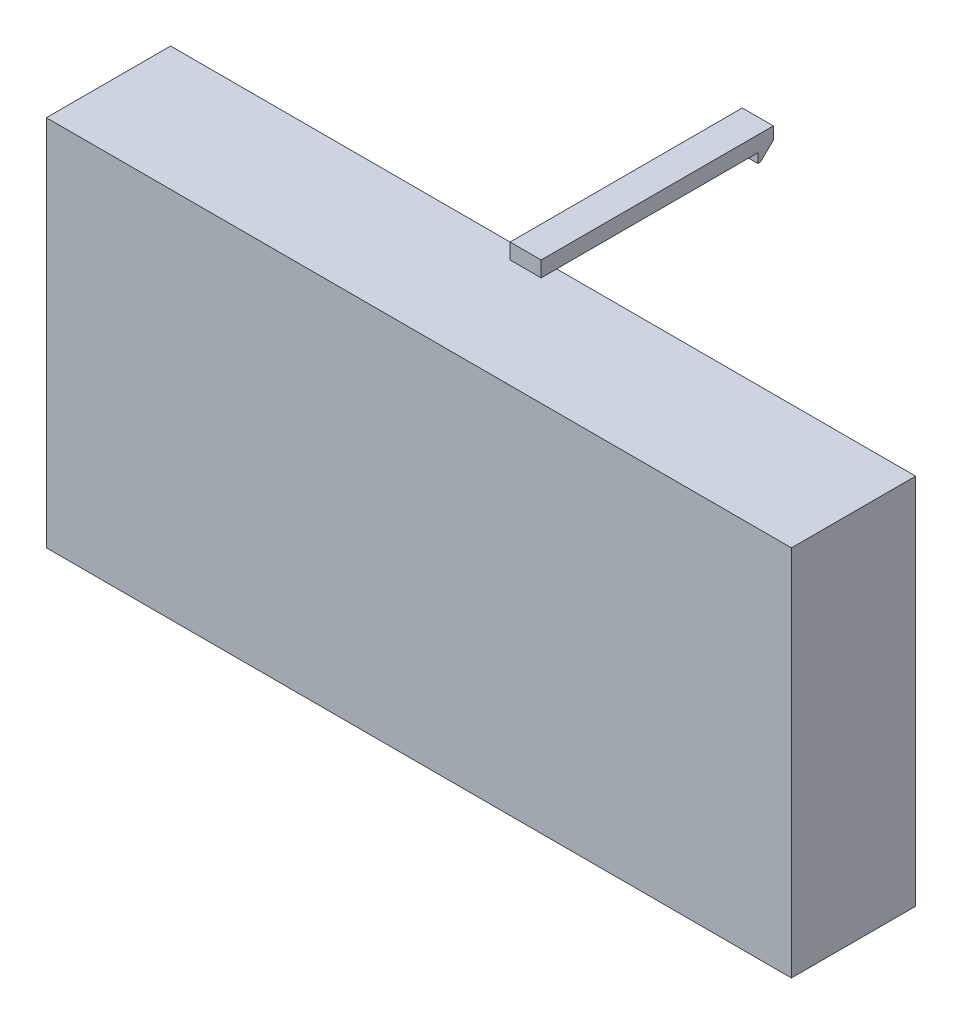
from build123d import *

# Parameters (mm, degrees)
SKETCH1_W           = 304.8
SKETCH1_H           = 152.4
BOSS_EXTRUDE1_DEPTH = 50.8
SHELL1_T            = -3.175
SKETCH3_W           = 12.7
SKETCH3_H           = 6.35
BOSS_EXTRUDE2_DEPTH = 6.35
SKETCH4_W           = 12.7
SKETCH4_H           = 6.35
BOSS_EXTRUDE3_DEPTH = 88.646
SKETCH5_W           = 12.7
SKETCH5_H           = 6.35
BOSS_EXTRUDE4_DEPTH = 3.81
CUT_EXTRUDE1_REACH  = 242.848


with BuildPart() as part:
    # Sketch1 → Boss-Extrude1 (new body)
    with BuildSketch(Plane.XY):
        with Locations((152.4, 76.2)):
            Rectangle(SKETCH1_W, SKETCH1_H)
    extrude(amount=BOSS_EXTRUDE1_DEPTH)

    # Shell1
    shell1_openings = [part.faces().sort_by_distance(p)[0] for p in [
        (152.4, 76.2, 0),
    ]]
    offset(amount=SHELL1_T, openings=shell1_openings, kind=Kind.INTERSECTION)

    # Sketch3 → Boss-Extrude2 (add)
    with BuildSketch(Plane(origin=(0, 152.4, 0), x_dir=(1, 0, 0), z_dir=(0, 1, 0))):
        with Locations((151.599627363, -3.175)):
            Rectangle(SKETCH3_W, SKETCH3_H)
    boss_extrude2 = extrude(amount=BOSS_EXTRUDE2_DEPTH)

    # Sketch4 → Boss-Extrude3 (add)
    with BuildSketch(Plane(origin=(0, 0, 0), x_dir=(-1, 0, 0), z_dir=(0, 0, -1))):
        with Locations((-151.599627363, 155.575)):
            Rectangle(SKETCH4_W, SKETCH4_H)
    boss_extrude3 = extrude(amount=BOSS_EXTRUDE3_DEPTH)

    # Sketch5 → Boss-Extrude4 (add)
    with BuildSketch(Plane.XZ.offset(-152.4)):
        with Locations((151.599627363, -85.471)):
            Rectangle(SKETCH5_W, SKETCH5_H)
    boss_extrude4 = extrude(amount=BOSS_EXTRUDE4_DEPTH)

    # Sketch6 → Cut-Extrude1 (cut, up to next)
    with BuildSketch(Plane(origin=(157.949627363, 0, 0), x_dir=(0, 0, -1), z_dir=(1, 0, 0)), mode=Mode.PRIVATE) as cut_extrude1_sk1:
        Polygon((83.385506006, 148.59), (88.646, 153.67), (88.646, 148.59), align=None)
    cut_extrude1_tool1 = extrude(cut_extrude1_sk1.sketch, amount=-CUT_EXTRUDE1_REACH, mode=Mode.PRIVATE) & part.part
    cut_extrude1 = cut_extrude1_tool1.solids().sort_by_distance((157.949627, 150.283333, -86.892502))[0]
    add(cut_extrude1, mode=Mode.SUBTRACT)

    # Mirror1: Boss-Extrude2, Boss-Extrude3, Boss-Extrude4, Cut-Extrude1 across plane
    add(boss_extrude2.mirror(Plane(origin=(0, 76.2, 0), x_dir=(0, 0, 1), z_dir=(0, -1, 0))))
    add(boss_extrude3.mirror(Plane(origin=(0, 76.2, 0), x_dir=(0, 0, 1), z_dir=(0, -1, 0))))
    add(boss_extrude4.mirror(Plane(origin=(0, 76.2, 0), x_dir=(0, 0, 1), z_dir=(0, -1, 0))))
    add(cut_extrude1.mirror(Plane(origin=(0, 76.2, 0), x_dir=(0, 0, 1), z_dir=(0, -1, 0))), mode=Mode.SUBTRACT)


solid = part.part
